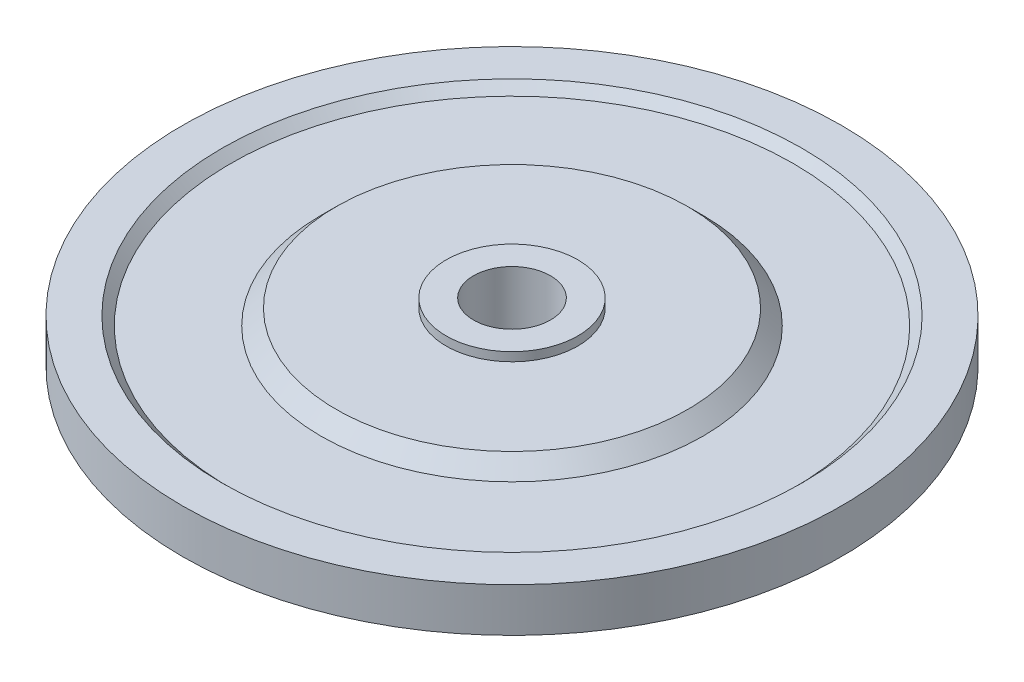
from build123d import *


with BuildPart() as part:
    # 草图1 → 旋转1 (revolve)
    with BuildSketch(Plane.XY, mode=Mode.PRIVATE) as revolve_1_sk:
        Polygon((-17.5, 0), (-17.5, 34), (-30, 34), (-30, 30), (-80, 30), (-87, 23), (-128, 23), (-132, 27), (-150, 27), (-150, 7), (-132, 7), (-128, 11), (-32.5, 11), (-32.5, 0), align=None)
    revolve(revolve_1_sk.sketch.rotate(Axis((0, 0, 0), (0, 1, 0)), 270), axis=Axis((0, 0, 0), (0, 1, 0)))


solid = part.part
